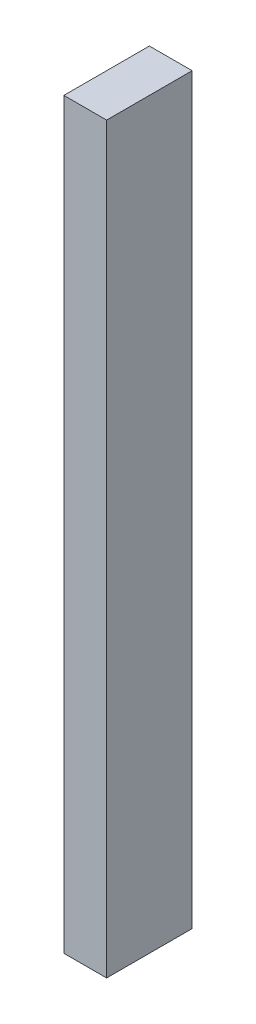
from build123d import *

# Parameters (mm, degrees)
SKETCH1_W           = 40
SKETCH1_H           = 80
BOSS_EXTRUDE1_DEPTH = 695


with BuildPart() as part:
    # Sketch1 → Boss-Extrude1 (new body)
    with BuildSketch(Plane(origin=(0, 0, 0), x_dir=(1, 0, 0), z_dir=(0, 1, 0))):
        Rectangle(SKETCH1_W, SKETCH1_H)
    extrude(amount=BOSS_EXTRUDE1_DEPTH)


solid = part.part
